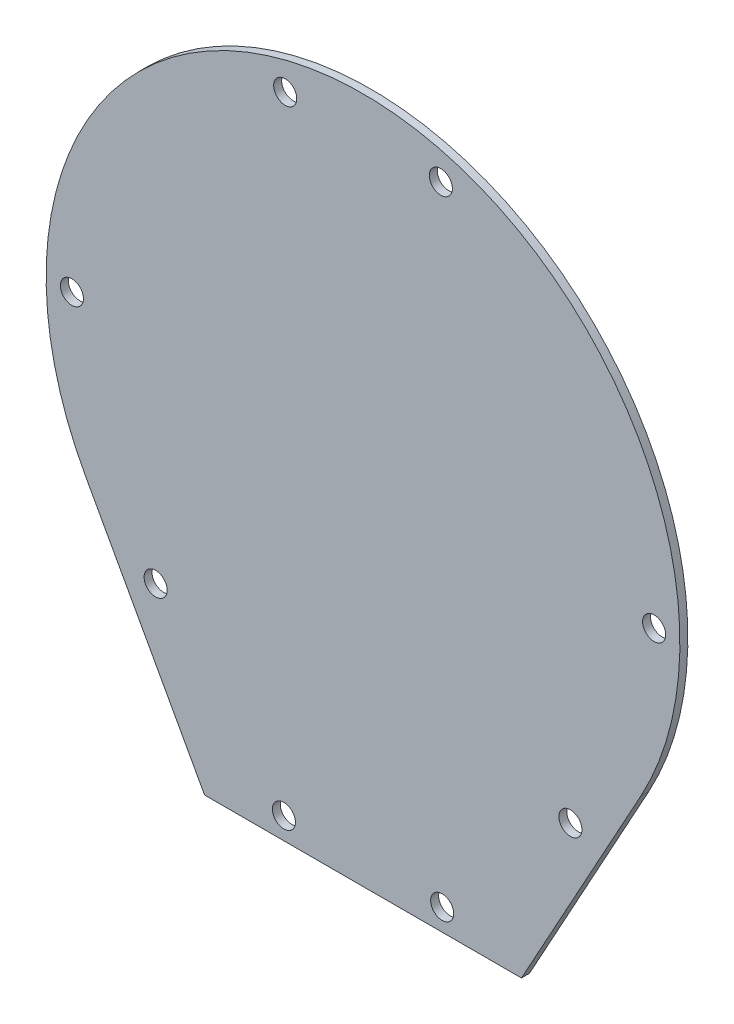
from build123d import *

# Parameters (mm, degrees)
BOSS_EXTRUDE1_DEPTH   = 0.75438
ESBO_O1_R             = 1.09200001
CORTE_EXTRUS_O1_DEPTH = 10


with BuildPart() as part:
    # Sketch1 → Boss-Extrude1 (new body)
    with BuildSketch(Plane.XY):
        with BuildLine():
            Line((-15, -35), (15, -35))
            Line((15, -35), (26.292884648, -14.44590658))
            ThreePointArc((26.292884648, -14.44590658), (0, 30), (-26.292884648, -14.44590658))
            Line((-26.292884648, -14.44590658), (-15, -35))
        make_face()
    extrude(amount=BOSS_EXTRUDE1_DEPTH)

    # Esboço1 → Corte-extrusão1 (cut)
    with BuildSketch(Plane.XY.offset(0.75438)):
        with Locations((-7.4931, -32.938)):
            Circle(ESBO_O1_R)
        with Locations((-7.366, 26.4469878)):
            Circle(ESBO_O1_R)
        with Locations((-27.559, -0.0450022)):
            Circle(ESBO_O1_R)
        with Locations((-19.634, -19.9840012)):
            Circle(ESBO_O1_R)
        with Locations((7.366, 26.4469878)):
            Circle(ESBO_O1_R)
        with Locations((7.4931, -32.938)):
            Circle(ESBO_O1_R)
        with Locations((19.634, -19.9840012)):
            Circle(ESBO_O1_R)
        with Locations((27.559, -0.0450022)):
            Circle(ESBO_O1_R)
    extrude(amount=-CORTE_EXTRUS_O1_DEPTH, mode=Mode.SUBTRACT)


solid = part.part
